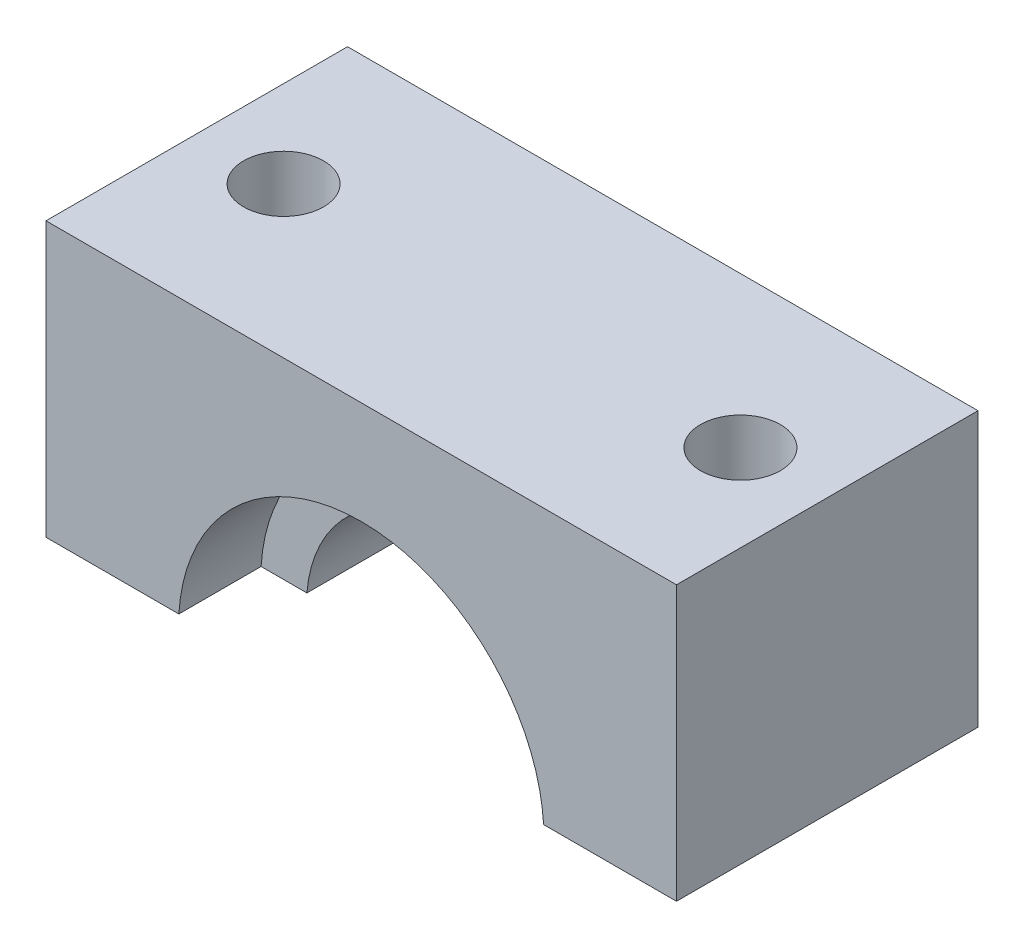
from build123d import *

# Parameters (mm, degrees)
ESTRUSIONE_ESTRUSIONE1_DEPTH = 3
ESTRUSIONE_ESTRUSIONE2_DEPTH = 6.6
SCHIZZO3_R                   = 1.75
TAGLIO_ESTRUSIONE1_DEPTH     = 20.442222095


with BuildPart() as part:
    # Schizzo1 → Estrusione-Estrusione1 (new, symmetric)
    with BuildSketch(Plane.XY):
        with BuildLine():
            Line((-13.8, 6), (13.8, 6))
            Line((13.8, 6), (13.8, -6))
            Line((13.8, -6), (5.979130372, -6))
            ThreePointArc((5.979130372, -6), (0, -0.5), (-5.979130372, -6))
            Line((-5.979130372, -6), (-13.8, -6))
            Line((-13.8, -6), (-13.8, 6))
        make_face()
    extrude(amount=ESTRUSIONE_ESTRUSIONE1_DEPTH, both=True)

    # Schizzo2 → Estrusione-Estrusione2 (add, symmetric)
    with BuildSketch(Plane.XY):
        with BuildLine():
            Line((13.8, 6), (-13.8, 6))
            Line((-13.8, 6), (-13.8, -6))
            Line((-13.8, -6), (-7.984359711, -6))
            ThreePointArc((-7.984359711, -6), (0, 1.5), (7.984359711, -6))
            Line((7.984359711, -6), (13.8, -6))
            Line((13.8, -6), (13.8, 6))
        make_face()
    extrude(amount=ESTRUSIONE_ESTRUSIONE2_DEPTH, both=True)

    # Schizzo3 → Taglio-Estrusione1 (cut, through all)
    with BuildSketch(Plane.XZ.offset(6)):
        with Locations((-10, 0)):
            Circle(SCHIZZO3_R)
        with Locations((10, 0)):
            Circle(SCHIZZO3_R)
    extrude(amount=-TAGLIO_ESTRUSIONE1_DEPTH, mode=Mode.SUBTRACT)


solid = part.part
